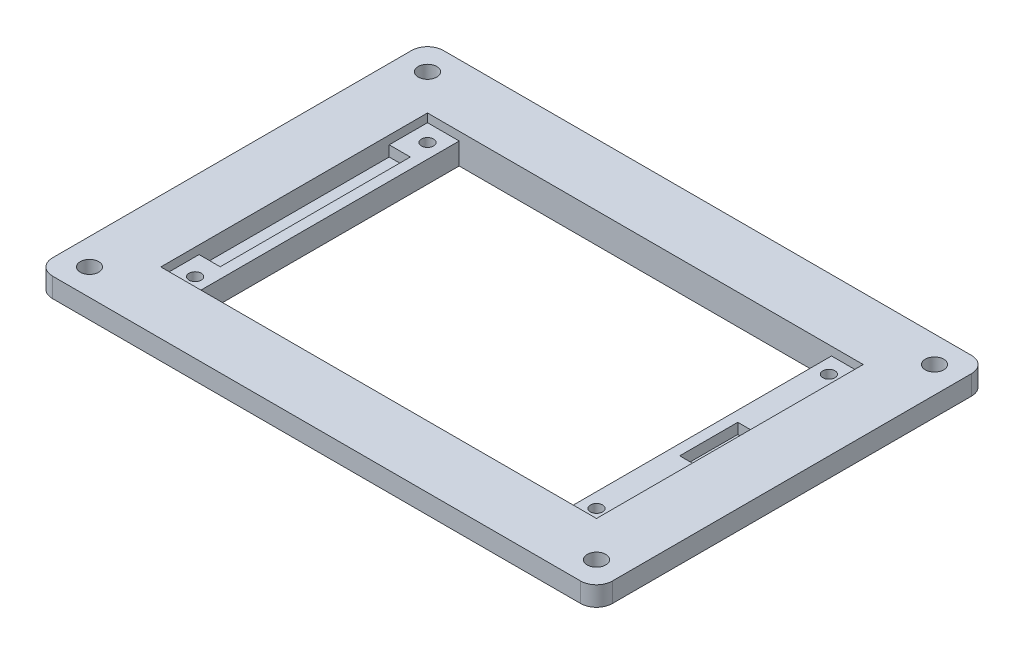
from build123d import *

# Parameters (mm, degrees)
SKETCH_1_W          = 106
SKETCH_1_H          = 74
EXTRUDE_1_DEPTH     = 5.7
SKETCH_2_W          = 70.5
SKETCH_2_H          = 50.5
CUT_EXTRUDE_1_DEPTH = 130.400502317
SKETCH_3_W          = 82.5
SKETCH_3_H          = 50.5
CUT_EXTRUDE_2_DEPTH = 1.6
SKETCH_4_W          = 4
SKETCH_4_H          = 11
SKETCH_4_H_2        = 36
CUT_EXTRUDE_3_DEPTH = 2
SKETCH_5_R          = 1.15
CUT_EXTRUDE_4_DEPTH = 3.9
CUT_EXTRUDE_START   = -5.7
SKETCH_6_W          = 131.135040239
SKETCH_6_H          = 88.560038322
SKETCH_6_W_2        = 88.5
SKETCH_6_H_2        = 56.5
CUT_EXTRUDE_5_DEPTH = 2
SKETCH_7_R          = 1.75
CUT_EXTRUDE_6_DEPTH = 130.32783923
FILLET_1_R          = 3


with BuildPart() as part:
    # Эскиз1 → Бобышка-Вытянуть1 (new body)
    with BuildSketch(Plane(origin=(0, 0, 0), x_dir=(1, 0, 0), z_dir=(0, 1, 0))):
        with Locations((53, 37)):
            Rectangle(SKETCH_1_W, SKETCH_1_H)
    extrude(amount=EXTRUDE_1_DEPTH)

    # Эскиз2 → Вырез-Вытянуть1 (cut, through all)
    with BuildSketch(Plane(origin=(0, 5.7, 0), x_dir=(1, 0, 0), z_dir=(0, 1, 0))):
        with Locations((53, 37)):
            Rectangle(SKETCH_2_W, SKETCH_2_H)
    extrude(amount=-CUT_EXTRUDE_1_DEPTH, mode=Mode.SUBTRACT)

    # Эскиз3 → Вырез-Вытянуть2 (cut)
    with BuildSketch(Plane(origin=(0, 5.7, 0), x_dir=(1, 0, 0), z_dir=(0, 1, 0))):
        with Locations((53, 37)):
            Rectangle(SKETCH_3_W, SKETCH_3_H)
    extrude(amount=-CUT_EXTRUDE_2_DEPTH, mode=Mode.SUBTRACT)

    # Эскиз4 → Вырез-Вытянуть3 (cut)
    with BuildSketch(Plane(origin=(0, 4.1, 0), x_dir=(1, 0, 0), z_dir=(0, 1, 0))):
        with Locations((92.25, 37)):
            Rectangle(SKETCH_4_W, SKETCH_4_H)
        with Locations((13.75, 37)):
            Rectangle(SKETCH_4_W, SKETCH_4_H_2)
    extrude(amount=-CUT_EXTRUDE_3_DEPTH, mode=Mode.SUBTRACT)

    # Эскиз5 → Вырез-Вытянуть4 (cut)
    with BuildSketch(Plane(origin=(0, 4.1, 0), x_dir=(1, 0, 0), z_dir=(0, 1, 0))):
        with Locations(Location((15, 59, 0), (0, 0, 270))):
            Circle(SKETCH_5_R)
        with Locations(Location((91, 59, 0), (0, 0, 270))):
            Circle(SKETCH_5_R)
        with Locations(Location((91, 15, 0), (0, 0, 270))):
            Circle(SKETCH_5_R)
        with Locations(Location((15, 15, 0), (0, 0, 270))):
            Circle(SKETCH_5_R)
    extrude(amount=-CUT_EXTRUDE_4_DEPTH, mode=Mode.SUBTRACT)

    # Эскиз6 → Вырез-Вытянуть5 (cut)
    with BuildSketch(Plane(origin=(0, 5.7, 0), x_dir=(1, 0, 0), z_dir=(0, 1, 0)).offset(CUT_EXTRUDE_START)):
        with Locations((54.065232984, 39.640866481)):
            Rectangle(SKETCH_6_W, SKETCH_6_H)
        with Locations((53, 37)):
            Rectangle(SKETCH_6_W_2, SKETCH_6_H_2, mode=Mode.SUBTRACT)
    extrude(amount=CUT_EXTRUDE_5_DEPTH, mode=Mode.SUBTRACT)

    # Эскиз7 → Вырез-Вытянуть6 (cut, through all)
    with BuildSketch(Plane.XZ.offset(-2)):
        with Locations(Location((5, -5, 0), (0, 0, 270))):
            Circle(SKETCH_7_R)
        with Locations(Location((101, -5, 0), (0, 0, 270))):
            Circle(SKETCH_7_R)
        with Locations(Location((101, -69, 0), (0, 0, 270))):
            Circle(SKETCH_7_R)
        with Locations(Location((5, -69, 0), (0, 0, 270))):
            Circle(SKETCH_7_R)
    extrude(amount=-CUT_EXTRUDE_6_DEPTH, mode=Mode.SUBTRACT)

    # Скругление1
    fillet_1_edges = [part.edges().sort_by_distance(p)[0] for p in [
        (0, 3.85, -74),
        (106, 3.85, -74),
        (106, 3.85, 0),
        (0, 3.85, 0),
    ]]
    fillet(fillet_1_edges, radius=FILLET_1_R)


solid = part.part
